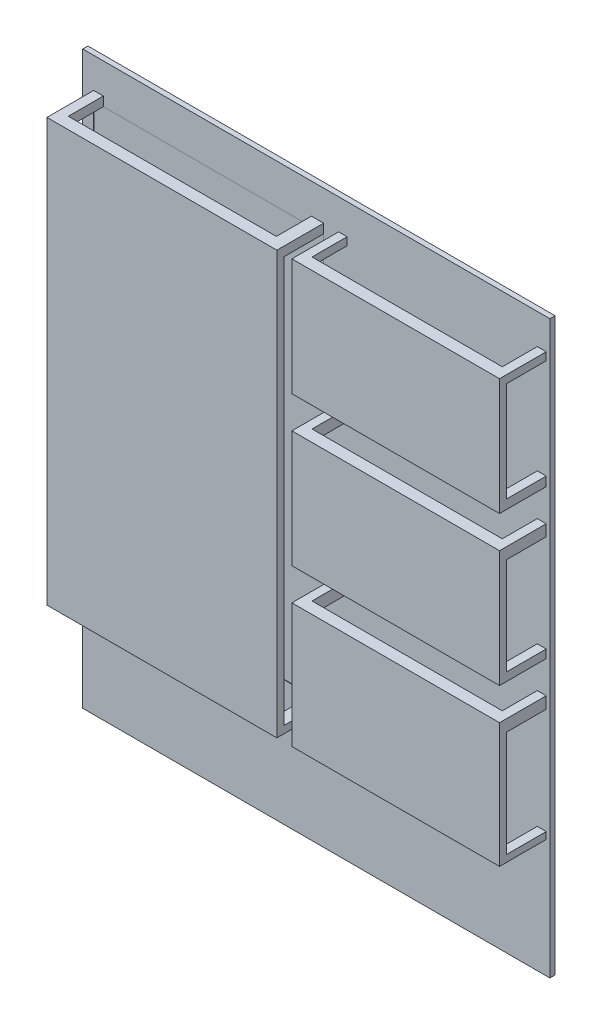
from build123d import *

# Parameters (mm, degrees)
SKETCH1_W               = 180
SKETCH1_H               = 220
BASE_DEPTH              = 2
SKETCH2_W               = 88.607017387
SKETCH2_H               = 162.747582956
SKETCH2_W_2             = 80
SKETCH2_H_2             = 45
SKETCH2_H_3             = 47.956874403
BOARDS_DEPTH            = 20
CUT_EXTRUDE1_DEPTH      = 285.956136976
CUT_EXTRUDE1_DEPTH_BACK = 285.956136976
SKETCH3_W               = 80.16842423
SKETCH3_H               = 13.497664936
SKETCH3_W_2             = 73.29684501
SKETCH4_W               = 15.397369521
SKETCH4_H               = 156.425076719
CUT_EXTRUDE2_DEPTH      = 88.607017387
SKETCH5_W               = 15.24584824
SKETCH5_H               = 38.4651821
SKETCH5_H_2             = 37.437486396
SKETCH5_H_3             = 40.814200855
CUT_EXTRUDE3_DEPTH      = 80


with BuildPart() as part:
    # Sketch1 → Base (new body)
    with BuildSketch(Plane.XY):
        with Locations((90, 110)):
            Rectangle(SKETCH1_W, SKETCH1_H)
    extrude(amount=BASE_DEPTH)

    # Sketch2 → Boards (add)
    with BuildSketch(Plane.XY):
        with Locations((48.5089102, 126.904245713)):
            Rectangle(SKETCH2_W, SKETCH2_H)
        with Locations((138.596199401, 185.778037191)):
            Rectangle(SKETCH2_W_2, SKETCH2_H_2)
        with Locations((138.596199401, 128.382682915)):
            Rectangle(SKETCH2_W_2, SKETCH2_H_2)
        with Locations((138.596199401, 69.508891437)):
            Rectangle(SKETCH2_W_2, SKETCH2_H_3)
    extrude(amount=BOARDS_DEPTH)

    # Sketch3 → Cut-Extrude1 (cut, two sides: drawn at the far end of the back side and taken through both)
    with BuildSketch(Plane(origin=(0, 0, 0), x_dir=(1, 0, 0), z_dir=(0, 1, 0)).offset(-CUT_EXTRUDE1_DEPTH_BACK)):
        with Locations((48.029472021, -8.748832468)):
            Rectangle(SKETCH3_W, SKETCH3_H)
        with Locations((138.50526508, -8.748832468)):
            Rectangle(SKETCH3_W_2, SKETCH3_H)
    extrude(amount=CUT_EXTRUDE1_DEPTH + CUT_EXTRUDE1_DEPTH_BACK, mode=Mode.SUBTRACT)

    # Sketch4 → Cut-Extrude2 (cut)
    with BuildSketch(Plane(origin=(92.812418893, 0, 0), x_dir=(0, 0, -1), z_dir=(1, 0, 0))):
        with Locations((-9.547163479, 126.516271725)):
            Rectangle(SKETCH4_W, SKETCH4_H)
    extrude(amount=-CUT_EXTRUDE2_DEPTH, mode=Mode.SUBTRACT)

    # Sketch5 → Cut-Extrude3 (cut)
    with BuildSketch(Plane(origin=(178.596199401, 0, 0), x_dir=(0, 0, -1), z_dir=(1, 0, 0))):
        with Locations((-9.62292412, 186.029564078)):
            Rectangle(SKETCH5_W, SKETCH5_H)
        with Locations((-9.62292412, 127.817943074)):
            Rectangle(SKETCH5_W, SKETCH5_H_2)
        with Locations((-9.62292412, 68.578626366)):
            Rectangle(SKETCH5_W, SKETCH5_H_3)
    extrude(amount=-CUT_EXTRUDE3_DEPTH, mode=Mode.SUBTRACT)


solid = part.part
